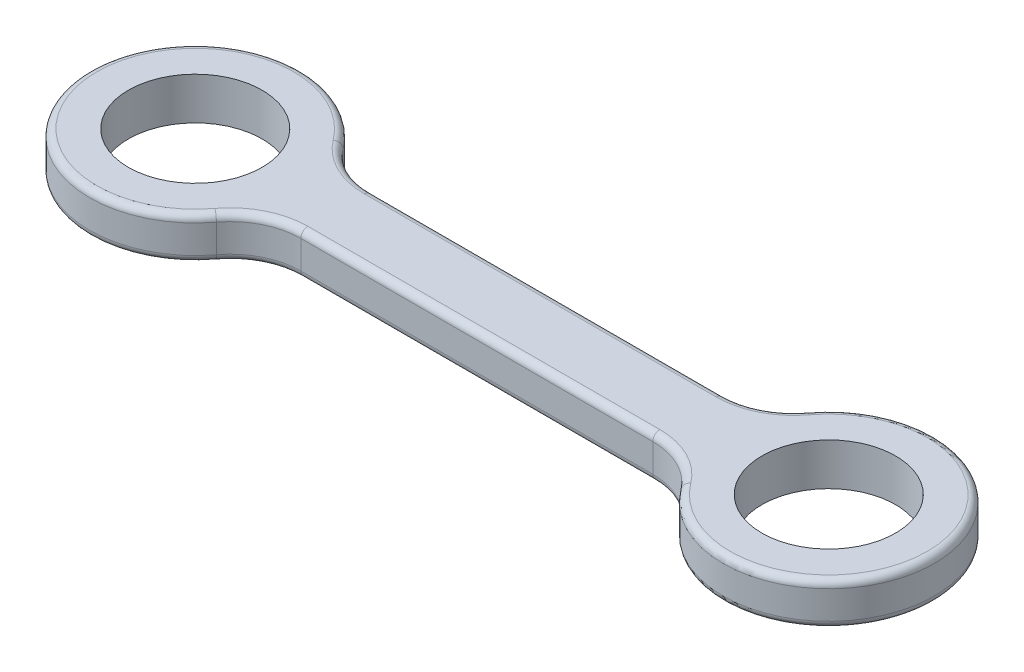
from build123d import *

# Parameters (mm, degrees)
SKETCH1_R           = 9.5
BOSS_EXTRUDE1_DEPTH = 6
FILLET1_R           = 1


with BuildPart() as part:
    # Sketch1 → Boss-Extrude1 (new body)
    with BuildSketch(Plane(origin=(0, 0, 0), x_dir=(1, 0, 0), z_dir=(0, 1, 0))):
        with BuildLine():
            Line((-28.045977011, 5), (21.954022989, 5))
            ThreePointArc((21.954022989, 5), (26.426158944, 6.05572809), (29.954022989, 9))
            ThreePointArc((29.954022989, 9), (56.954022989, 0), (29.954022989, -9))
            ThreePointArc((29.954022989, -9), (26.426158944, -6.05572809), (21.954022989, -5))
            Line((21.954022989, -5), (-28.045977011, -5))
            ThreePointArc((-28.045977011, -5), (-32.518112966, -6.05572809), (-36.045977011, -9))
            ThreePointArc((-36.045977011, -9), (-63.045977011, 0), (-36.045977011, 9))
            ThreePointArc((-36.045977011, 9), (-32.518112966, 6.05572809), (-28.045977011, 5))
        make_face()
        with Locations(Location((-48.045977011, 0, 0), (0, 0, 270))):
            Circle(SKETCH1_R, mode=Mode.SUBTRACT)
        with Locations(Location((41.954022989, 0, 0), (0, 0, 270))):
            Circle(SKETCH1_R, mode=Mode.SUBTRACT)
    extrude(amount=BOSS_EXTRUDE1_DEPTH)

    # Fillet1
    fillet1_edges = [part.edges().sort_by_distance(p)[0] for p in [
        (-63.045977011, 0, 0),
        (-32.518112966, 0, -6.05572809),
        (-3.045977011, 0, -5),
        (26.426158944, 0, -6.05572809),
        (-32.518112966, 6, -6.05572809),
        (-63.045977011, 6, 0),
        (-32.518112966, 6, 6.05572809),
        (-3.045977011, 6, 5),
        (26.426158944, 6, 6.05572809),
        (56.954022989, 6, 0),
        (26.426158944, 6, -6.05572809),
        (56.954022989, 0, 0),
        (-3.045977011, 6, -5),
        (26.426158944, 0, 6.05572809),
        (-3.045977011, 0, 5),
        (-32.518112966, 0, 6.05572809),
    ]]
    fillet(fillet1_edges, radius=FILLET1_R)


solid = part.part
